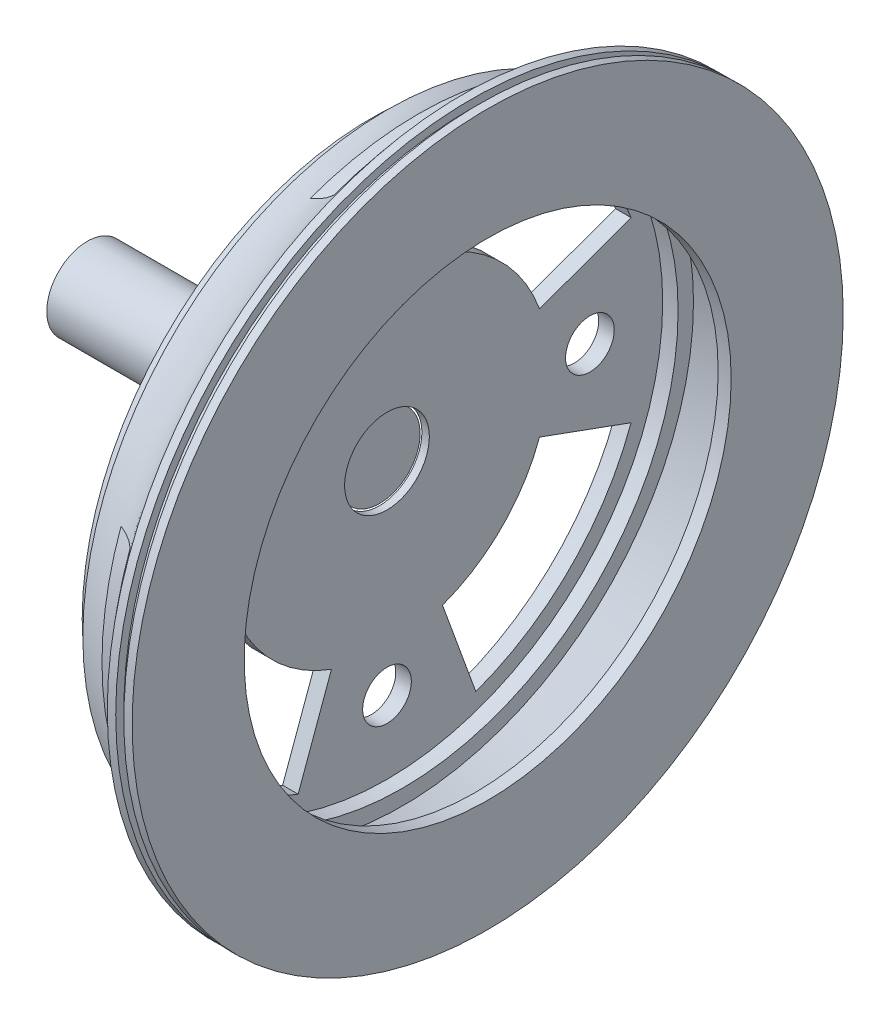
from build123d import *

# Parameters (mm, degrees)
SKETCH6_R           = 1.5
CUT_EXTRUDE2_DEPTH  = 10
SKETCH7_R           = 1.5
CUT_EXTRUDE3_DEPTH  = 10
SKETCH9_R           = 15
CUT_EXTRUDE6_DEPTH  = 2
SKETCH10_R          = 7
CUT_EXTRUDE10_DEPTH = 0.5
SKETCH11_R          = 8
CUT_EXTRUDE11_DEPTH = 0.3
CUT_EXTRUDE12_DEPTH = 5.5
CIRPATTERN1_COUNT   = 4
CUT_EXTRUDE13_DEPTH = 5.5
CIRPATTERN2_COUNT   = 4
SKETCH14_R          = 2.5
BOSS_EXTRUDE1_DEPTH = 18


with BuildPart() as part:
    # Sketch1 → Revolve5 (revolve)
    with BuildSketch(Plane(origin=(0, 0, 0), x_dir=(1, 0, 0), z_dir=(0, 1, 0))):
        with BuildLine():
            Line((-0.801439764, 0), (0, 0))
            Line((0, 0), (0, 21.902624806))
            Line((0, 21.902624806), (-0.51174357, 21.902624806))
            Line((-0.51174357, 21.902624806), (-0.51174357, 21.390881236))
            Line((-0.51174357, 21.390881236), (-1.02348714, 21.390881236))
            Line((-1.02348714, 21.390881236), (-1.02348714, 21.890510973))
            Line((-1.02348714, 21.890510973), (-1.544434098, 21.890510973))
            add(Edge.make_bspline(
                [(-6.202911031, 18.737475773), (-3.305817899, 19.500531362), (-1.544434098, 21.890510973)],
                knots=[0, 0, 0, 1, 1, 1], degree=2))
            Line((-6.202911031, 18.737475773), (-6.202911031, 17.818076408))
            Line((-6.202911031, 17.818076408), (-7.161566328, 17.818076408))
            Line((-7.161566328, 17.818076408), (-7.161566328, 2.608912222))
            Line((-7.161566328, 2.608912222), (-6.202911031, 2.608912222))
            Line((-6.202911031, 2.608912222), (-6.202911031, 16.984870734))
            Line((-6.202911031, 16.984870734), (-5.254780436, 16.984870734))
            Line((-5.254780436, 16.984870734), (-5.254780436, 17.933123671))
            Line((-5.254780436, 17.933123671), (-0.801439764, 20.748661883))
            Line((-0.801439764, 20.748661883), (-0.801439764, 0))
        make_face()
    revolve(axis=Axis((0, 0, 0), (-1, 0, 0)))

    # Sketch6 → Cut-Extrude2 (cut)
    with BuildSketch(Plane.ZY.offset(7.161566328)):
        with Locations((0, 12.5)):
            Circle(SKETCH6_R)
    extrude(amount=-CUT_EXTRUDE2_DEPTH, mode=Mode.SUBTRACT)

    # Sketch7 → Cut-Extrude3 (cut)
    with BuildSketch(Plane.ZY.offset(7.161566328)):
        with Locations((12.5, 0)):
            Circle(SKETCH7_R)
        with Locations((0, -12.5)):
            Circle(SKETCH7_R)
        with Locations((-12.5, 0)):
            Circle(SKETCH7_R)
    extrude(amount=-CUT_EXTRUDE3_DEPTH, mode=Mode.SUBTRACT)

    # Sketch9 → Cut-Extrude6 (cut)
    with BuildSketch(Plane(origin=(0, 0, 0), x_dir=(0, 0, -1), z_dir=(1, 0, 0))):
        Circle(SKETCH9_R)
    extrude(amount=-CUT_EXTRUDE6_DEPTH, mode=Mode.SUBTRACT)

    # Sketch10 → Cut-Extrude10 (cut)
    with BuildSketch(Plane.ZY.offset(7.161566328)):
        Circle(SKETCH10_R)
    extrude(amount=-CUT_EXTRUDE10_DEPTH, mode=Mode.SUBTRACT)

    # Sketch11 → Cut-Extrude11 (cut)
    with BuildSketch(Plane.ZY.offset(7.161566328)):
        Circle(SKETCH11_R)
    extrude(amount=-CUT_EXTRUDE11_DEPTH, mode=Mode.SUBTRACT)

    # Sketch12 → Cut-Extrude12 (cut)
    with BuildSketch(Plane.ZY.offset(7.161566328)):
        with BuildLine():
            ThreePointArc((-6.669392795, 18.324006105), (0, 19.5), (6.669392795, 18.324006105))
            Line((6.669392795, 18.324006105), (7.18242301, 19.733545037))
            ThreePointArc((7.18242301, 19.733545037), (0, 21), (-7.18242301, 19.733545037))
            Line((-7.18242301, 19.733545037), (-6.669392795, 18.324006105))
        make_face()
    cut_extrude12 = extrude(amount=-CUT_EXTRUDE12_DEPTH, mode=Mode.SUBTRACT)

    # CirPattern1: Cut-Extrude12 ×4 about axis
    cirpattern1_axis = Axis((-6.661566328, 0, 0), (-1, 0, 0))
    for i in range(1, CIRPATTERN1_COUNT):
        add(cut_extrude12.rotate(cirpattern1_axis, i * 360 / CIRPATTERN1_COUNT), mode=Mode.SUBTRACT)

    # Sketch13 → Cut-Extrude13 (cut)
    with BuildSketch(Plane.ZY.offset(7.161566328)):
        with BuildLine():
            Line((3.420201433, 9.396926208), (5.472322293, 15.035081933))
            ThreePointArc((5.472322293, 15.035081933), (11.313708499, 11.313708499), (15.035081933, 5.472322293))
            Line((15.035081933, 5.472322293), (9.396926208, 3.420201433))
            ThreePointArc((9.396926208, 3.420201433), (7.071067812, 7.071067812), (3.420201433, 9.396926208))
        make_face()
    cut_extrude13 = extrude(amount=-CUT_EXTRUDE13_DEPTH, mode=Mode.SUBTRACT)

    # CirPattern2: Cut-Extrude13 ×4 about axis
    cirpattern2_axis = Axis((-6.661566328, 0, 0), (-1, 0, 0))
    for i in range(1, CIRPATTERN2_COUNT):
        add(cut_extrude13.rotate(cirpattern2_axis, i * 360 / CIRPATTERN2_COUNT), mode=Mode.SUBTRACT)


with BuildPart() as body_2:
    # Sketch14 → Boss-Extrude1 (new body)
    with BuildSketch(Plane.ZY.offset(6.661566328)):
        Circle(SKETCH14_R)
    extrude(amount=BOSS_EXTRUDE1_DEPTH)


solid = Compound([part.part, body_2.part])
